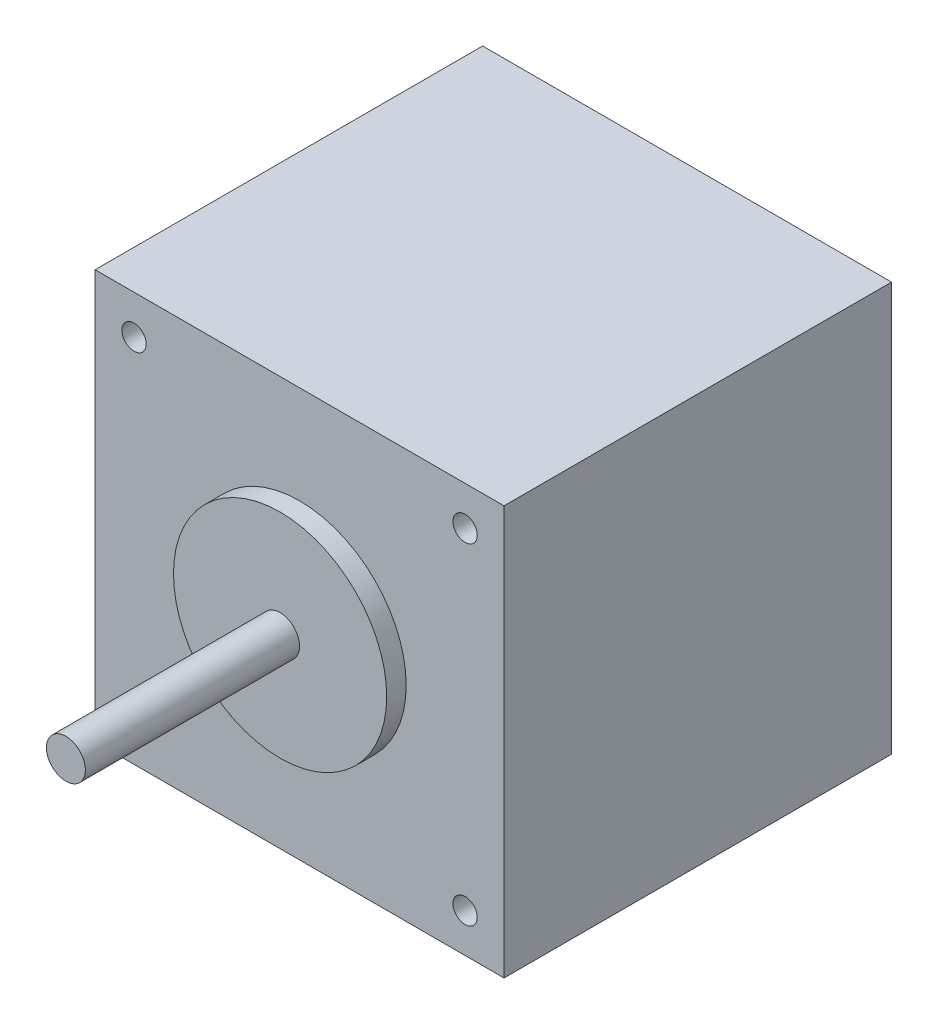
from build123d import *

# Parameters (mm, degrees)
SKETCH1_W           = 42
SKETCH1_H           = 42
BOSS_EXTRUDE1_DEPTH = 39.8
SKETCH2_R           = 10.95
BOSS_EXTRUDE2_DEPTH = 2
SKETCH3_R           = 1.25
CUT_EXTRUDE1_DEPTH  = 10
SKETCH4_R           = 2
BOSS_EXTRUDE3_DEPTH = 22


with BuildPart() as part:
    # Sketch1 → Boss-Extrude1 (new body)
    with BuildSketch(Plane.XY):
        Rectangle(SKETCH1_W, SKETCH1_H)
    extrude(amount=BOSS_EXTRUDE1_DEPTH)

    # Sketch2 → Boss-Extrude2 (add)
    with BuildSketch(Plane.XY.offset(39.8)):
        Circle(SKETCH2_R)
    extrude(amount=BOSS_EXTRUDE2_DEPTH)

    # Sketch3 → Cut-Extrude1 (cut)
    with BuildSketch(Plane.XY.offset(39.8)):
        with Locations((-17, 17)):
            Circle(SKETCH3_R)
        with Locations((17, 17)):
            Circle(SKETCH3_R)
        with Locations((17, -17)):
            Circle(SKETCH3_R)
        with Locations((-17, -17)):
            Circle(SKETCH3_R)
    extrude(amount=-CUT_EXTRUDE1_DEPTH, mode=Mode.SUBTRACT)

    # Sketch4 → Boss-Extrude3 (add)
    with BuildSketch(Plane.XY.offset(41.8)):
        Circle(SKETCH4_R)
    extrude(amount=BOSS_EXTRUDE3_DEPTH)


solid = part.part
